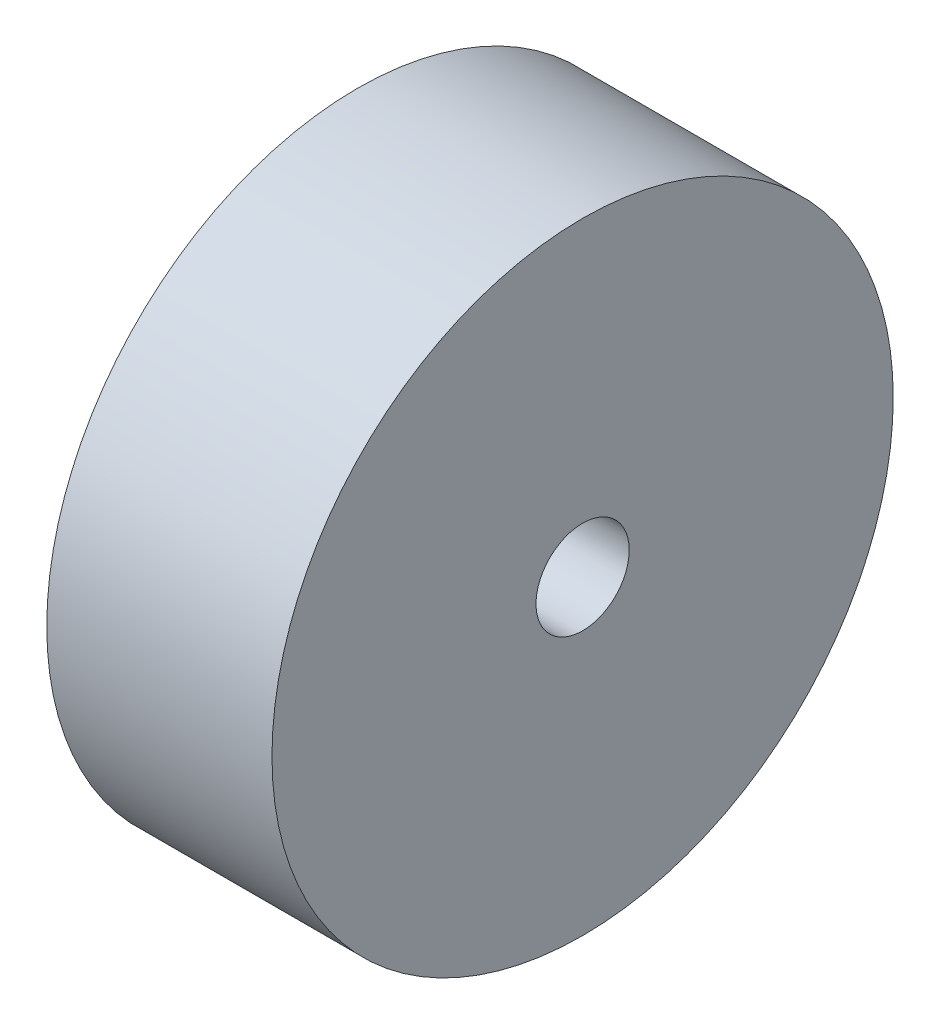
from build123d import *

# Parameters (mm, degrees)
ESBO_O1_R                = 10
RESSALTO_EXTRUS_O1_DEPTH = 4.25
RESSALTO_EXTRUS_O2_START = 3
ESBO_O2_R                = 10
RESSALTO_EXTRUS_O2_DEPTH = 3
CORTE_EXTRUS_O1_REACH    = 17.892
ESBO_O3_R                = 1.5
ESBO_O5_R                = 6
CORTE_EXTRUS_O3_DEPTH    = 2.5


with BuildPart() as part:
    # Esboço1 → Ressalto-extrusão1 (new body)
    with BuildSketch(Plane(origin=(0, 0, 0), x_dir=(0, 0, -1), z_dir=(1, 0, 0))):
        Circle(ESBO_O1_R)
    extrude(amount=RESSALTO_EXTRUS_O1_DEPTH)

    # Esboço2 → Ressalto-extrusão2 (add)
    with BuildSketch(Plane.ZY.offset(RESSALTO_EXTRUS_O2_START)):
        Circle(ESBO_O2_R)
    extrude(amount=-RESSALTO_EXTRUS_O2_DEPTH)

    # Esboço3 → Corte-extrusão1 (cut, up to next)
    with BuildSketch(Plane(origin=(4.25, 0, 0), x_dir=(0, 0, -1), z_dir=(1, 0, 0)), mode=Mode.PRIVATE) as corte_extrus_o1_sk1:
        Circle(ESBO_O3_R)
    corte_extrus_o1_tool1 = extrude(corte_extrus_o1_sk1.sketch, amount=-CORTE_EXTRUS_O1_REACH, mode=Mode.PRIVATE) & part.part
    add(corte_extrus_o1_tool1.solids().sort_by_distance((4.25, 0, 0))[0], mode=Mode.SUBTRACT)

    # Esboço5 → Corte-extrusão3 (cut)
    with BuildSketch(Plane.ZY.offset(3)):
        Circle(ESBO_O5_R)
    extrude(amount=-CORTE_EXTRUS_O3_DEPTH, mode=Mode.SUBTRACT)


solid = part.part
